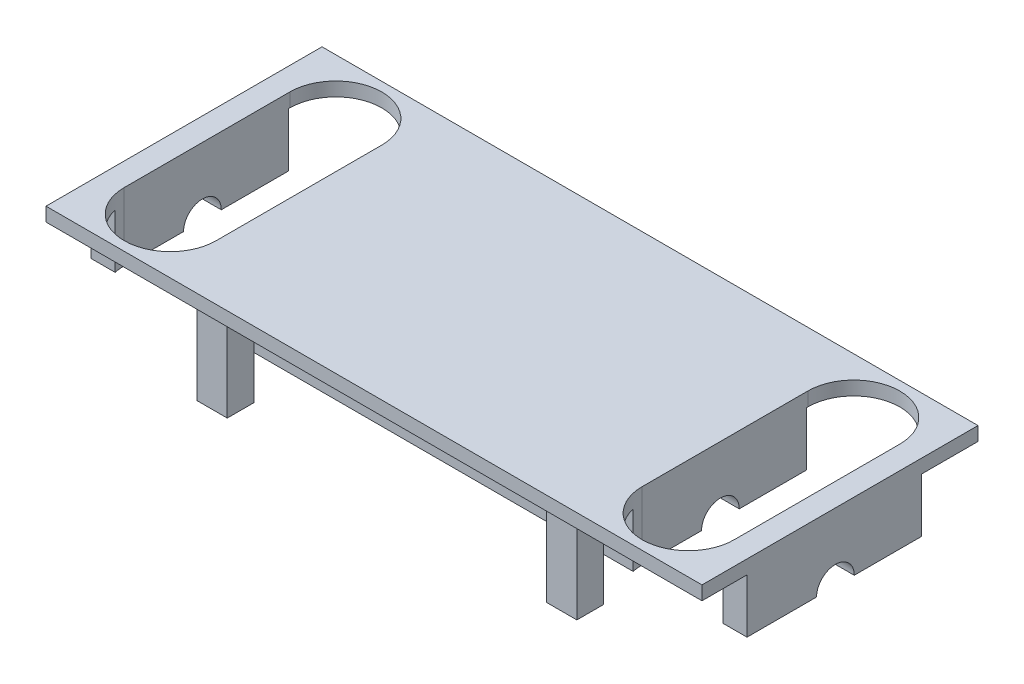
from build123d import *

# Parameters (mm, degrees)
GUIDE_RODS_DEPTH   = 25.4
GUIDE_RODS_2_DEPTH = 25.4
SKETCH2_W          = 181.102
SKETCH2_H          = 76.2
BASEPLATE_DEPTH    = 3.81
ROD_CUP_DEPTH      = 181.102
HANDLES_DEPTH      = 154.034720609


with BuildPart() as part:
    # Sketch1 → Guide rods (new body)
    with BuildSketch(Plane(origin=(0, 0, 0), x_dir=(1, 0, 0), z_dir=(0, 1, 0))):
        Polygon((-5.842, 0), (-7.112, -1.244340789), (-7.112, -8.610340789), (1.27, -8.610340789), (1.27, -1.244340789), (0, 0), align=None)
    extrude(amount=GUIDE_RODS_DEPTH)



with BuildPart() as body_2:
    # Sketch1 → Guide rods 2 (new body)
    with BuildSketch(Plane(origin=(0, 0, 0), x_dir=(1, 0, 0), z_dir=(0, 1, 0))):
        Polygon((90.678, 0), (89.408, -1.244340789), (89.408, -8.610340789), (97.79, -8.610340789), (97.79, -1.244340789), (96.52, 0), align=None)
    extrude(amount=GUIDE_RODS_2_DEPTH)


with BuildPart() as part_1:
    add(part.part)

    add(body_2.part)  # baseplate merges body 2
    # Sketch2 → baseplate (add)
    with BuildSketch(Plane(origin=(0, 25.4, 0), x_dir=(1, 0, 0), z_dir=(0, 1, 0))):
        with Locations((45.339, 25.933659211)):
            Rectangle(SKETCH2_W, SKETCH2_H)
    extrude(amount=BASEPLATE_DEPTH)

    # Sketch3 → rod cup (add)
    with BuildSketch(Plane.ZY.offset(45.212)):
        with BuildLine():
            Line((-48.370526129, 25.4), (-0.263262521, 25.4))
            Line((-0.263262521, 25.4), (-0.263262521, 10.48765464))
            Line((-0.263262521, 10.48765464), (-19.456659211, 10.48765464))
            ThreePointArc((-19.456659211, 10.48765464), (-24.663659211, 15.69465464), (-29.870659211, 10.48765464))
            Line((-29.870659211, 10.48765464), (-48.370526129, 10.48765464))
            Line((-48.370526129, 10.48765464), (-48.370526129, 25.4))
        make_face()
    extrude(amount=-ROD_CUP_DEPTH)

    # Sketch4 → Handles (cut, through all)
    with BuildSketch(Plane(origin=(0, 29.21, 0), x_dir=(1, 0, 0), z_dir=(0, 1, 0))):
        with BuildLine():
            Line((-13.462, 48.793659211), (-13.462, 3.073659211))
            ThreePointArc((-13.462, 3.073659211), (-26.162, -9.626340789), (-38.862, 3.073659211))
            Line((-38.862, 3.073659211), (-38.862, 48.793659211))
            ThreePointArc((-38.862, 48.793659211), (-26.162, 61.493659211), (-13.462, 48.793659211))
        make_face()
        with BuildLine():
            Line((104.14, 48.793659211), (104.14, 3.073659211))
            ThreePointArc((104.14, 3.073659211), (116.84, -9.626340789), (129.54, 3.073659211))
            Line((129.54, 3.073659211), (129.54, 48.793659211))
            ThreePointArc((129.54, 48.793659211), (116.84, 61.493659211), (104.14, 48.793659211))
        make_face()
    extrude(amount=-HANDLES_DEPTH, mode=Mode.SUBTRACT)


solid = part_1.part
